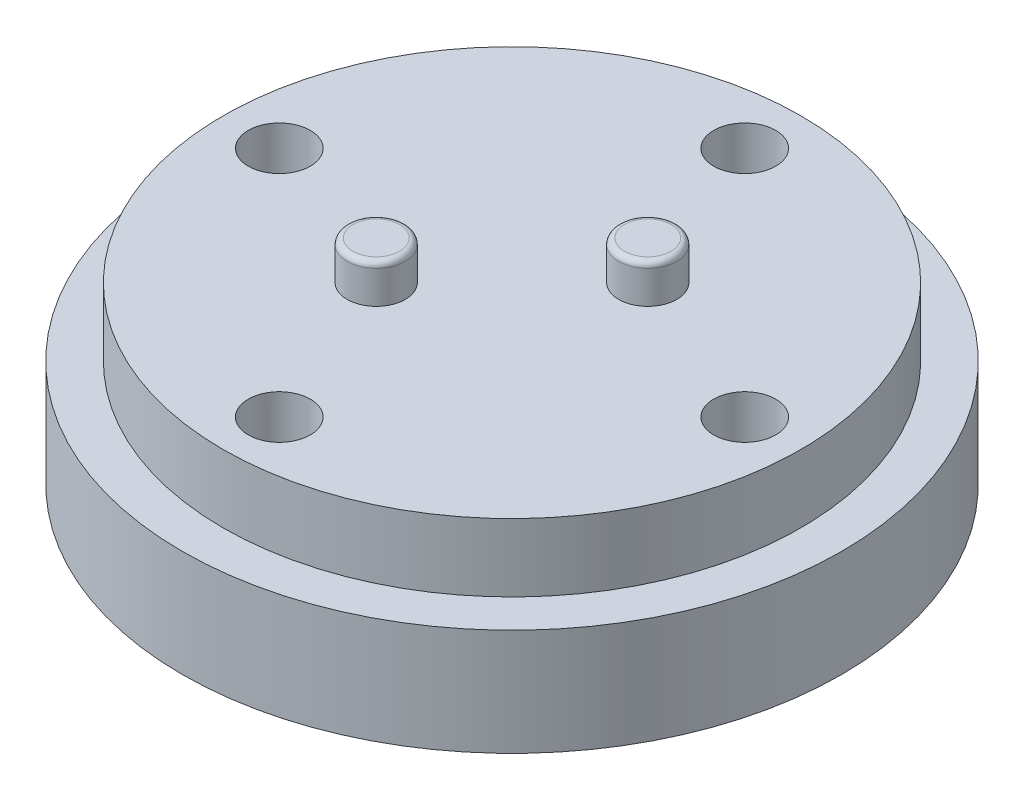
from build123d import *
from build123d.topology import SkipClean

# Parameters (mm, degrees)
SKETCH1_R           = 14.9
SKETCH1_R_2         = 1.5
SKETCH1_R_3         = 1.6
BOSS_EXTRUDE1_DEPTH = 3.5
BOSS_EXTRUDE2_START = 3.5
SKETCH1_3_R         = 1.5
BOSS_EXTRUDE2_DEPTH = 2
FILLET1_R           = 0.3
BOSS_EXTRUDE3_START = 5.5
SKETCH2_R           = 17
SKETCH2_R_2         = 1.6
BOSS_EXTRUDE3_DEPTH = 5.5
BOSS_EXTRUDE4_DEPTH = 3
FILLET2_R           = 0.5


with BuildPart() as part:
    # Sketch1 → Boss-Extrude1 (new body)
    # profile 1 of 3: a face of its own
    with BuildSketch(Plane(origin=(0, 0, 0), x_dir=(1, 0, 0), z_dir=(0, 1, 0))):
        with Locations(Location((0, 0, 0), (0, 0, 270))):
            Circle(SKETCH1_R)
        with Locations((-3.5, -3.5)):
            Circle(SKETCH1_R_2, mode=Mode.SUBTRACT)
        with Locations((3.5, 3.5)):
            Circle(SKETCH1_R_2, mode=Mode.SUBTRACT)
        with Locations(Location((12, 0, 0), (0, 0, 270))):
            Circle(SKETCH1_R_3, mode=Mode.SUBTRACT)
        with Locations(Location((0, 12, 0), (0, 0, 270))):
            Circle(SKETCH1_R_3, mode=Mode.SUBTRACT)
        with Locations(Location((-12, 0, 0), (0, 0, 270))):
            Circle(SKETCH1_R_3, mode=Mode.SUBTRACT)
        with Locations(Location((0, -12, 0), (0, 0, 270))):
            Circle(SKETCH1_R_3, mode=Mode.SUBTRACT)
    # profile 2 of 3: a face of its own
    with BuildSketch(Plane(origin=(0, 0, 0), x_dir=(1, 0, 0), z_dir=(0, 1, 0))):
        with Locations((-3.5, -3.5)):
            Circle(SKETCH1_R_2)
    # profile 3 of 3: a face of its own
    with BuildSketch(Plane(origin=(0, 0, 0), x_dir=(1, 0, 0), z_dir=(0, 1, 0))):
        with Locations((3.5, 3.5)):
            Circle(SKETCH1_R_2)
    extrude(amount=BOSS_EXTRUDE1_DEPTH)

    # Sketch1<3> → Boss-Extrude2 (add)
    with BuildSketch(Plane(origin=(0, 0, 0), x_dir=(1, 0, 0), z_dir=(0, 1, 0)).offset(BOSS_EXTRUDE2_START)):
        with Locations(Location((-3.5, -3.5, 0), (0, 0, 270))):
            Circle(SKETCH1_3_R)
        with Locations(Location((3.5, 3.5, 0), (0, 0, 270))):
            Circle(SKETCH1_3_R)
    extrude(amount=BOSS_EXTRUDE2_DEPTH)

    # Fillet1
    fillet1_edges = [part.edges().sort_by_distance(p)[0] for p in [
        (-3.5, 5.5, 2),
        (3.5, 5.5, -5),
    ]]
    fillet(fillet1_edges, radius=FILLET1_R)

    # Sketch2 → Boss-Extrude3 (add)
    with SkipClean():  # the faces are left unmerged after this step: merging them gives an invalid solid
        with BuildSketch(Plane.XZ.offset(BOSS_EXTRUDE3_START)):
            with Locations(Location((0, 0, 0), (0, 0, 270))):
                Circle(SKETCH2_R)
            with Locations(Location((-12, 0, 0), (0, 0, 270))):
                Circle(SKETCH2_R_2, mode=Mode.SUBTRACT)
            with Locations(Location((0, -12, 0), (0, 0, 270))):
                Circle(SKETCH2_R_2, mode=Mode.SUBTRACT)
            with Locations(Location((12, 0, 0), (0, 0, 270))):
                Circle(SKETCH2_R_2, mode=Mode.SUBTRACT)
            with Locations(Location((0, 12, 0), (0, 0, 270))):
                Circle(SKETCH2_R_2, mode=Mode.SUBTRACT)
        extrude(amount=-BOSS_EXTRUDE3_DEPTH)

    # Sketch3 → Boss-Extrude4 (add)
    with SkipClean():  # the faces are left unmerged after this step: merging them gives an invalid solid
        with BuildSketch(Plane.XZ.offset(5.5)):
            with BuildLine():
                Line((-4.101219331, -1.414213562), (-1.414213562, -4.101219331))
                ThreePointArc((-1.414213562, -4.101219331), (0, -4.687005769), (1.414213562, -4.101219331))
                Line((1.414213562, -4.101219331), (4.101219331, -1.414213562))
                ThreePointArc((4.101219331, -1.414213562), (4.687005769, 0), (4.101219331, 1.414213562))
                Line((4.101219331, 1.414213562), (1.414213562, 4.101219331))
                ThreePointArc((1.414213562, 4.101219331), (0, 4.687005769), (-1.414213562, 4.101219331))
                Line((-1.414213562, 4.101219331), (-4.101219331, 1.414213562))
                ThreePointArc((-4.101219331, 1.414213562), (-4.687005769, 0), (-4.101219331, -1.414213562))
            make_face()
        extrude(amount=BOSS_EXTRUDE4_DEPTH)

    # Fillet2
    fillet2_edges = [part.edges().sort_by_distance(p)[0] for p in [
        (4.687005769, -8.5, 0),
        (2.757716447, -8.5, 2.757716447),
        (0, -8.5, 4.687005769),
        (-2.757716447, -8.5, 2.757716447),
        (-4.687005769, -8.5, 0),
        (-2.757716447, -8.5, -2.757716447),
        (0, -8.5, -4.687005769),
        (2.757716447, -8.5, -2.757716447),
    ]]
    fillet(fillet2_edges, radius=FILLET2_R)


solid = part.part
